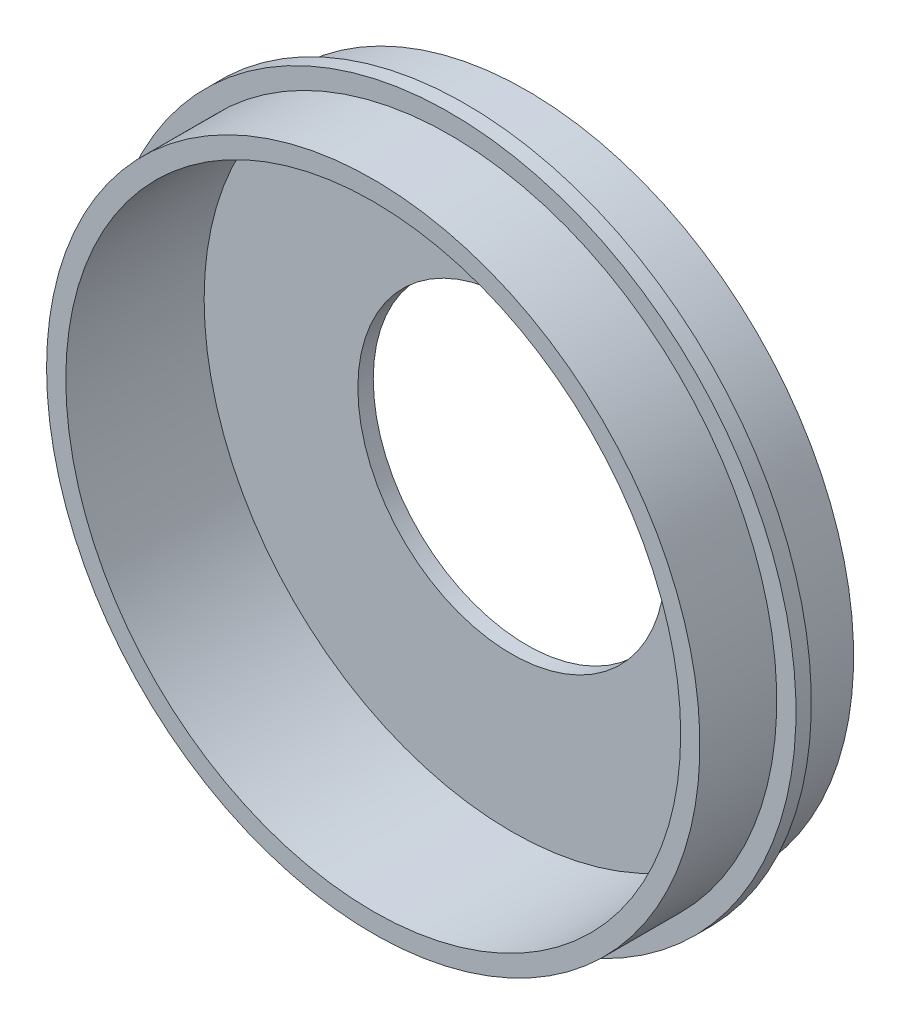
from build123d import *


with BuildPart() as part:
    # Sketch6 → Revolve1 (revolve)
    with BuildSketch(Plane(origin=(0, 0, 0), x_dir=(0, 0, -1), z_dir=(1, 0, 0)), mode=Mode.PRIVATE) as revolve1_sk:
        Polygon((0, 25.4), (-2.54, 25.4), (-2.54, 50.8), (-25.4, 50.8), (-25.4, 53.975), (-12.7, 53.975), (-12.7, 57.15), (-10.16, 57.15), (-10.16, 53.975), (0, 53.975), align=None)
    revolve(revolve1_sk.sketch.rotate(Axis((0, 0, 0), (0, 0, 1)), 90), axis=Axis((0, 0, 0), (0, 0, 1)))


solid = part.part
